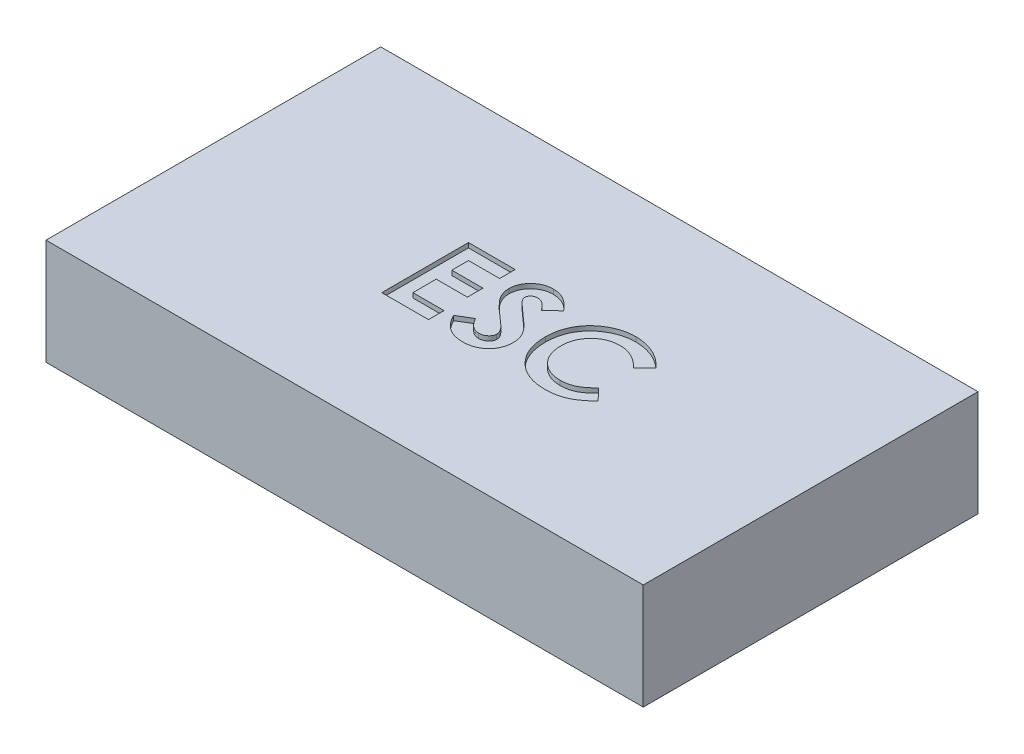
from build123d import *

# Parameters (mm, degrees)
SKETCH1_W           = 103.3
SKETCH1_H           = 57.9
BOSS_EXTRUDE1_DEPTH = 18.3
CUT_EXTRUDE1_DEPTH  = 0.8


with BuildPart() as part:
    # Sketch1 → Boss-Extrude1 (new body)
    with BuildSketch(Plane(origin=(0, 0, 0), x_dir=(1, 0, 0), z_dir=(0, 1, 0))):
        Rectangle(SKETCH1_W, SKETCH1_H)
    extrude(amount=BOSS_EXTRUDE1_DEPTH)

    # Sketch2 → Cut-Extrude1 (cut)
    with BuildSketch(Plane(origin=(0, 18.3, 0), x_dir=(1, 0, 0), z_dir=(0, 1, 0))):
        Polygon((-14.750130117, 7.223298576), (-6.67320704, 7.223298576), (-6.67320704, 4.530990884), (-12.057822425, 4.530990884), (-12.057822425, 1.646375499), (-6.67320704, 1.646375499), (-6.67320704, -1.045932193), (-12.057822425, -1.045932193), (-12.057822425, -5.084393732), (-6.67320704, -5.084393732), (-6.67320704, -7.776701424), (-14.750130117, -7.776701424), align=None)
        with BuildLine():
            Line((3.711408344, 5.219091845), (1.69818719, 3.37714473))
            add(Edge.make_bspline(
                [(1.69818719, 3.37714473), (1.611949429, 3.498792058), (1.446384952, 3.732337964), (1.178022205, 4.045061437), (0.910871254, 4.311837832), (0.642457106, 4.53155268), (0.370400642, 4.702871051), (0.095174112, 4.82416635), (-0.181662149, 4.901274923), (-0.367653382, 4.910876795), (-0.459264733, 4.915606268)],
                knots=[0, 0, 0, 0, 1.299362458, 2.494594718, 3.587462134, 4.587049575, 5.512617175, 6.380583204, 7.202344345, 8, 8, 8, 8], degree=3))
            add(Edge.make_bspline(
                [(-0.459264733, 4.915606268), (-0.544717172, 4.912609457), (-0.709703382, 4.906823403), (-0.944903465, 4.84931045), (-1.153717447, 4.75005154), (-1.335941537, 4.620262165), (-1.480289901, 4.463896058), (-1.595540876, 4.299908217), (-1.660436859, 4.118902727), (-1.668978447, 3.994580854), (-1.67320704, 3.933034153)],
                knots=[0, 0, 0, 0, 1.185010067, 2.2879431, 3.333075148, 4.379039566, 5.372662701, 6.27520591, 7.14612461, 8, 8, 8, 8], degree=3))
            add(Edge.make_bspline(
                [(-1.67320704, 3.933034153), (-1.670557196, 3.870599921), (-1.665220776, 3.744866053), (-1.613678231, 3.560587411), (-1.535988898, 3.380525727), (-1.461753569, 3.270913611), (-1.423808002, 3.214885115)],
                knots=[0, 0, 0, 0, 0.967525499, 1.948461899, 2.951351359, 4, 4, 4, 4], degree=3))
            add(Edge.make_bspline(
                [(-1.423808002, 3.214885115), (-1.389311376, 3.17133475), (-1.3099047, 3.071087563), (-1.158492433, 2.912311645), (-0.968350424, 2.717797248), (-0.732161608, 2.494233152), (-0.459730834, 2.233579117), (-0.138430583, 1.946081553), (0.222490723, 1.622836994), (0.479025226, 1.397741188), (0.613451614, 1.279788961)],
                knots=[0, 0, 0, 0, 0.473873513, 1.090794244, 1.870441696, 2.795289791, 3.865433203, 5.087734844, 6.473946851, 8, 8, 8, 8], degree=3))
            add(Edge.make_bspline(
                [(0.613451614, 1.279788961), (0.739630116, 1.170587832), (0.979090698, 0.963346776), (1.319795554, 0.669201372), (1.619218379, 0.404565925), (1.881721079, 0.173412045), (2.103324371, -0.026685599), (2.284959874, -0.196683474), (2.428845959, -0.333272033), (2.510636774, -0.415771605), (2.54554296, -0.45098027)],
                knots=[0, 0, 0, 0, 1.543621617, 2.929473131, 4.163658386, 5.240097082, 6.164993805, 6.925417477, 7.541396219, 8, 8, 8, 8], degree=3))
            add(Edge.make_bspline(
                [(2.54554296, -0.45098027), (2.67796975, -0.594294419), (2.932540548, -0.869794543), (3.263392843, -1.296733093), (3.535694984, -1.713512172), (3.746353084, -2.127974155), (3.905450553, -2.546098903), (4.017616377, -2.978140903), (4.084793235, -3.428614723), (4.092251435, -3.736008113), (4.096023729, -3.891485078)],
                knots=[0, 0, 0, 0, 1.206664779, 2.319633467, 3.337109185, 4.282041471, 5.190008762, 6.099243693, 7.03861361, 8, 8, 8, 8], degree=3))
            add(Edge.make_bspline(
                [(4.096023729, -3.891485078), (4.093338707, -4.042978312), (4.088070593, -4.340213677), (4.023546303, -4.775173359), (3.931538453, -5.191448652), (3.789278175, -5.584509892), (3.615892191, -5.96080906), (3.398527819, -6.314484611), (3.143263168, -6.649115888), (2.850690684, -6.958720945), (2.527070776, -7.239666075), (2.179957668, -7.489770066), (1.805957114, -7.696262768), (1.408264515, -7.866294779), (0.987092748, -7.997255707), (0.542943554, -8.094048038), (0.075137578, -8.15214127), (-0.24475489, -8.158214228), (-0.408183002, -8.161316809)],
                knots=[0, 0, 0, 0, 1.043214005, 2.046824704, 3.02475056, 3.976699089, 4.921714032, 5.875962561, 6.831408892, 7.817874052, 8.806269674, 9.781291748, 10.760897367, 11.74438705, 12.757449933, 13.795994037, 14.874007457, 16, 16, 16, 16], degree=3))
            add(Edge.make_bspline(
                [(-0.408183002, -8.161316809), (-0.536472678, -8.159040864), (-0.790559811, -8.154533189), (-1.165045832, -8.117731775), (-1.526654418, -8.058338207), (-1.87497825, -7.973209483), (-2.211586588, -7.865339843), (-2.536493256, -7.73358121), (-2.847455316, -7.575891375), (-3.146825655, -7.395513068), (-3.433148961, -7.186070093), (-3.710045682, -6.951844443), (-3.974765417, -6.689233624), (-4.22857956, -6.398858699), (-4.469864137, -6.079897396), (-4.706517259, -5.736791843), (-4.928021349, -5.363174465), (-5.064854279, -5.101078853), (-5.134745502, -4.967206232)],
                knots=[0, 0, 0, 0, 1.016823716, 2.013894106, 2.979844003, 3.91962641, 4.853723003, 5.779685073, 6.695824784, 7.614987388, 8.547259901, 9.504950863, 10.487499108, 11.500346958, 12.559593716, 13.656357062, 14.802919212, 16, 16, 16, 16], degree=3))
            Line((-5.134745502, -4.967206232), (-2.76695704, -3.545932193))
            add(Edge.make_bspline(
                [(-2.76695704, -3.545932193), (-2.679533566, -3.697895109), (-2.511935295, -3.989221008), (-2.227924355, -4.380654275), (-1.936969647, -4.715852074), (-1.632344557, -4.988889763), (-1.317753214, -5.203418206), (-0.991676067, -5.356735115), (-0.653884022, -5.451638108), (-0.423795427, -5.463227955), (-0.309024348, -5.469009116)],
                knots=[0, 0, 0, 0, 1.283663364, 2.460892379, 3.537111102, 4.529833553, 5.449777664, 6.316464042, 7.160231139, 8, 8, 8, 8], degree=3))
            add(Edge.make_bspline(
                [(-0.309024348, -5.469009116), (-0.19228573, -5.464287906), (0.034204192, -5.455128072), (0.357489572, -5.370521441), (0.65388985, -5.237682825), (0.91009606, -5.048140436), (1.127035326, -4.829379712), (1.287148956, -4.585998404), (1.387733419, -4.322665704), (1.398367635, -4.139737488), (1.403716037, -4.047735078)],
                knots=[0, 0, 0, 0, 1.13588714, 2.203786484, 3.234766741, 4.283437687, 5.291419208, 6.222934724, 7.106237994, 8, 8, 8, 8], degree=3))
            add(Edge.make_bspline(
                [(1.403716037, -4.047735078), (1.398777007, -3.962141806), (1.388743841, -3.78826727), (1.31484263, -3.529743794), (1.199312496, -3.271337888), (1.062632202, -3.059386374), (0.923542887, -2.881925116), (0.790542131, -2.728162964), (0.628582393, -2.558282705), (0.438074332, -2.372070642), (0.221535055, -2.167887503), (-0.021217843, -1.945753284), (-0.292964139, -1.707624719), (-0.485034957, -1.545413894), (-0.585466656, -1.460595655)],
                knots=[0, 0, 0, 0, 0.916159276, 1.861089862, 2.860218735, 3.940849679, 4.552606315, 5.27541173, 6.11797699, 7.06649574, 8.129236253, 9.306560635, 10.591630461, 12, 12, 12, 12], degree=3))
            add(Edge.make_bspline(
                [(-0.585466656, -1.460595655), (-0.776391312, -1.299055088), (-1.142833515, -0.989009844), (-1.66066284, -0.531082781), (-2.127273427, -0.10310798), (-2.538635127, 0.300205261), (-2.899989324, 0.671408682), (-3.20888877, 1.01351734), (-3.461940065, 1.329170134), (-3.728221988, 1.703039746), (-3.981243054, 2.158625556), (-4.199925056, 2.706748101), (-4.34179671, 3.254801097), (-4.357691455, 3.622733693), (-4.365514733, 3.803827422)],
                knots=[0, 0, 0, 0, 1.345494975, 2.582412109, 3.71882943, 4.751509156, 5.681369928, 6.505683931, 7.230279997, 7.856715994, 8.973648664, 10.023341002, 11.027102913, 12, 12, 12, 12], degree=3))
            add(Edge.make_bspline(
                [(-4.365514733, 3.803827422), (-4.362261042, 3.932249375), (-4.355850922, 4.185254418), (-4.298671662, 4.557261469), (-4.213215079, 4.916217016), (-4.089107588, 5.260811425), (-3.928031049, 5.590613079), (-3.73240985, 5.907236495), (-3.499206363, 6.207767542), (-3.236401777, 6.492006991), (-2.946858408, 6.7517695), (-2.637444523, 6.981035943), (-2.309911432, 7.174677714), (-1.966262816, 7.335317625), (-1.604369227, 7.458277271), (-1.22689672, 7.545437197), (-0.833303878, 7.597277142), (-0.565590523, 7.604324181), (-0.429216656, 7.607913961)],
                knots=[0, 0, 0, 0, 1.010766082, 1.991317756, 2.957454644, 3.913069143, 4.869106762, 5.843196583, 6.838735724, 7.860187025, 8.887984031, 9.89767229, 10.887916223, 11.879572884, 12.879850636, 13.892031539, 14.926195476, 16, 16, 16, 16], degree=3))
            add(Edge.make_bspline(
                [(-0.429216656, 7.607913961), (-0.252482873, 7.601448662), (0.099589618, 7.588569101), (0.62013895, 7.487855136), (1.128589773, 7.329471818), (1.538308975, 7.138399769), (1.864314897, 6.953308186), (2.114167983, 6.782899171), (2.368406946, 6.587686486), (2.629082067, 6.367054964), (2.891349597, 6.116847617), (3.162667057, 5.843020828), (3.439337416, 5.543208093), (3.619129282, 5.329023265), (3.711408344, 5.219091845)],
                knots=[0, 0, 0, 0, 1.282922637, 2.555718331, 3.837320111, 5.142675274, 5.830281639, 6.55870424, 7.337177975, 8.157850921, 9.037902056, 9.96903443, 10.957596896, 12, 12, 12, 12], degree=3))
        make_face()
        with BuildLine():
            Line((20.249869883, 4.621135115), (18.275711229, 2.734115884))
            add(Edge.make_bspline(
                [(18.275711229, 2.734115884), (18.108247009, 2.907274168), (17.781136922, 3.245506546), (17.254039472, 3.693296407), (16.705877316, 4.066468668), (16.147313855, 4.38075197), (15.56830215, 4.618529687), (14.975537154, 4.791802315), (14.365233889, 4.897440087), (13.952204113, 4.909526917), (13.744461229, 4.915606268)],
                knots=[0, 0, 0, 0, 1.115251505, 2.178435587, 3.19620269, 4.182487026, 5.141301733, 6.088180966, 7.038406374, 8, 8, 8, 8], degree=3))
            add(Edge.make_bspline(
                [(13.744461229, 4.915606268), (13.570970675, 4.910803368), (13.228606182, 4.901325375), (12.725925389, 4.831842331), (12.245085232, 4.713683392), (11.784439718, 4.550838486), (11.345344317, 4.34012582), (10.92687841, 4.081708482), (10.530073708, 3.777920346), (10.160171771, 3.430333227), (9.821798479, 3.050568179), (9.52282413, 2.64535978), (9.272385154, 2.215636337), (9.06685396, 1.765749776), (8.906753106, 1.293617797), (8.792420981, 0.79955826), (8.726294335, 0.282982776), (8.71642449, -0.068181388), (8.711408344, -0.246653347)],
                knots=[0, 0, 0, 0, 1.035432265, 2.043311493, 3.022114605, 3.98653278, 4.95457646, 5.923598177, 6.917315552, 7.932509744, 8.948865224, 9.949768934, 10.933144597, 11.912367597, 12.897413939, 13.903909035, 14.934704909, 16, 16, 16, 16], degree=3))
            add(Edge.make_bspline(
                [(8.711408344, -0.246653347), (8.71285394, -0.371917455), (8.71570324, -0.618815586), (8.74689386, -0.984046445), (8.797118112, -1.338406723), (8.86980505, -1.681359658), (8.960700779, -2.013202458), (9.067342167, -2.336797911), (9.201122219, -2.647674659), (9.349620095, -2.949443332), (9.522321414, -3.233869795), (9.708525294, -3.505094032), (9.910433002, -3.761786531), (10.129352305, -4.002897923), (10.36836422, -4.224660177), (10.621291173, -4.43374195), (10.892399692, -4.624909215), (11.176058167, -4.802959526), (11.474717046, -4.957633345), (11.780273024, -5.097737944), (12.097358944, -5.211523709), (12.422114095, -5.303245416), (12.753377917, -5.381241029), (13.094390476, -5.429265325), (13.442195622, -5.465633562), (13.677253522, -5.467879088), (13.79554296, -5.469009116)],
                knots=[0, 0, 0, 0, 1.103660481, 2.175337485, 3.227646561, 4.255952547, 5.262355991, 6.258840057, 7.255597736, 8.242457506, 9.22035537, 10.185017736, 11.140346927, 12.096287581, 13.051739095, 14.01125915, 14.986044842, 15.97314143, 16.960198552, 17.947847494, 18.933482797, 19.925264591, 20.920966487, 21.929612487, 22.958107872, 24, 24, 24, 24], degree=3))
            add(Edge.make_bspline(
                [(13.79554296, -5.469009116), (13.996182175, -5.463205565), (14.390386059, -5.451803097), (14.968936941, -5.36263741), (15.520238293, -5.2159649), (15.960725436, -5.042753189), (16.305835477, -4.871704375), (16.56856265, -4.713492646), (16.840243023, -4.536515456), (17.116364218, -4.334093495), (17.400032051, -4.108655907), (17.686239131, -3.855265188), (17.982312409, -3.582265132), (18.176267079, -3.387419629), (18.275711229, -3.287518732)],
                knots=[0, 0, 0, 0, 1.404581149, 2.759636711, 4.088442092, 5.392261763, 6.066678138, 6.783632037, 7.538459478, 8.336747902, 9.180226004, 10.074962426, 11.012997595, 12, 12, 12, 12], degree=3))
            Line((18.275711229, -3.287518732), (20.189773729, -5.297735078))
            add(Edge.make_bspline(
                [(20.189773729, -5.297735078), (20.055225438, -5.427637229), (19.792615947, -5.681178447), (19.396476822, -6.041183318), (19.000836253, -6.364687715), (18.615252092, -6.66343343), (18.23340807, -6.928717273), (17.85534468, -7.160804188), (17.485341764, -7.365563989), (17.115716094, -7.539543501), (16.744167668, -7.687270176), (16.361888, -7.814453147), (15.967708427, -7.922045365), (15.559221477, -8.008858154), (15.14023727, -8.078470292), (14.706834669, -8.125458082), (14.261761662, -8.15704641), (13.959861745, -8.159884883), (13.80756219, -8.161316809)],
                knots=[0, 0, 0, 0, 1.244526981, 2.429050516, 3.560637417, 4.644440555, 5.67424972, 6.652764056, 7.595344123, 8.486817594, 9.369275933, 10.254498637, 11.166417451, 12.086725134, 13.032340136, 13.991389299, 14.986715468, 16, 16, 16, 16], degree=3))
            add(Edge.make_bspline(
                [(13.80756219, -8.161316809), (13.527806774, -8.154185285), (12.980403185, -8.140230876), (12.1781975, -8.036838152), (11.416123632, -7.863502072), (10.6923276, -7.618357045), (10.007039553, -7.305195762), (9.360434809, -6.921274734), (8.753555551, -6.467613979), (8.19130417, -5.94953084), (7.682721036, -5.377351506), (7.233192443, -4.762987874), (6.861342374, -4.10342057), (6.552587249, -3.408393512), (6.311144802, -2.67473502), (6.14121025, -1.901651499), (6.036412853, -1.08988941), (6.024947868, -0.535437191), (6.019100652, -0.252662962)],
                knots=[0, 0, 0, 0, 1.078019885, 2.10938526, 3.111377082, 4.085535484, 5.04941344, 6.010039228, 6.978205633, 7.964457913, 8.951525778, 9.924444315, 10.892603023, 11.863865945, 12.85144698, 13.863884204, 14.910567087, 16, 16, 16, 16], degree=3))
            add(Edge.make_bspline(
                [(6.019100652, -0.252662962), (6.021571402, -0.068240023), (6.026467825, 0.297241168), (6.077929685, 0.835624574), (6.149670511, 1.360452092), (6.263480807, 1.866274274), (6.400667894, 2.359905477), (6.571278061, 2.835980508), (6.77503882, 3.295867654), (7.005382482, 3.740336792), (7.265967962, 4.166476175), (7.55707055, 4.570624594), (7.871196131, 4.955901999), (8.21589263, 5.317196971), (8.586151156, 5.657681749), (8.983643382, 5.975511183), (9.405978593, 6.275243303), (9.854299893, 6.549148747), (10.319897593, 6.796910779), (10.796899281, 7.015447474), (11.284133019, 7.198093825), (11.779538739, 7.349592236), (12.285209524, 7.462675087), (12.797536023, 7.548275158), (13.320877522, 7.596126144), (13.672256, 7.603959656), (13.849629498, 7.607913961)],
                knots=[0, 0, 0, 0, 1.071919942, 2.124283339, 3.142214191, 4.149696895, 5.136002878, 6.119640489, 7.086990633, 8.058538607, 9.028339693, 9.988281803, 10.952401235, 11.916291999, 12.888973767, 13.874849856, 14.873389453, 15.898127285, 16.927174885, 17.938320013, 18.946391617, 19.950418109, 20.947802303, 21.956882652, 22.968648068, 24, 24, 24, 24], degree=3))
            add(Edge.make_bspline(
                [(13.849629498, 7.607913961), (14.000947279, 7.605647255), (14.302009557, 7.60113741), (14.75034181, 7.563542951), (15.195088512, 7.504501233), (15.634657332, 7.415419854), (16.072192516, 7.309669001), (16.501944363, 7.171202844), (16.930692439, 7.016856219), (17.351712467, 6.832366345), (17.765592131, 6.630978982), (18.162635647, 6.402497705), (18.549509338, 6.160982997), (18.917640317, 5.892140959), (19.273924469, 5.605722992), (19.616498753, 5.300392795), (19.942356879, 4.971059618), (20.146847346, 4.738366287), (20.249869883, 4.621135115)],
                knots=[0, 0, 0, 0, 0.996412454, 1.982464992, 2.961075852, 3.949442424, 4.934965278, 5.923860011, 6.921385422, 7.934793307, 8.949617135, 9.951082467, 10.950285876, 11.951772932, 12.951063433, 13.960125323, 14.972308753, 16, 16, 16, 16], degree=3))
        make_face()
    extrude(amount=-CUT_EXTRUDE1_DEPTH, mode=Mode.SUBTRACT)


solid = part.part
